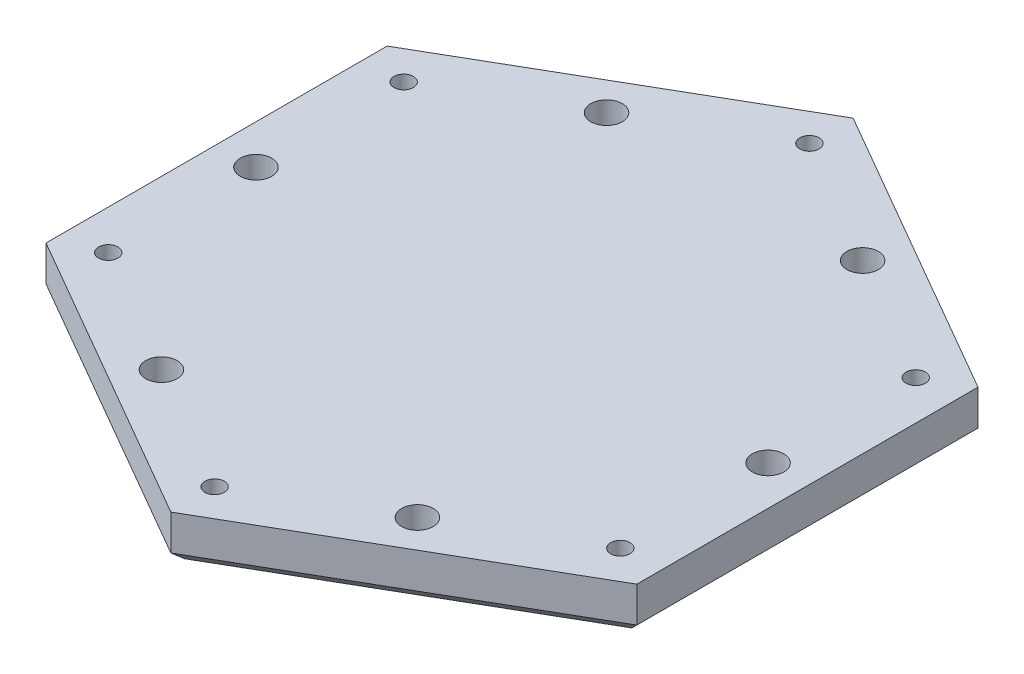
from build123d import *

# Parameters (mm, degrees)
EXTRUDE_1_DEPTH     = 12
CHAMFER_1_SIZE      = 3
SKETCH_2_R          = 4
EXTRUDE_2_DEPTH     = 12
HOLE_WIZARD_1_D     = 4.917
HOLE_WIZARD_1_DEPTH = 17.1
HOLE_WIZARD_1_TIP   = 1.477215832


with BuildPart() as part:
    # 草圖1 → 擠出1 (new body)
    with BuildSketch(Plane(origin=(0, 0, 0), x_dir=(-1, 0, 0), z_dir=(0, 1, 0))):
        Polygon((0, -86.602540378), (-75, -43.301270189), (-75, 43.301270189), (0, 86.602540378), (75, 43.301270189), (75, -43.301270189), align=None)
    extrude(amount=EXTRUDE_1_DEPTH)

    # 倒角1
    chamfer_1_edges = [part.edges().sort_by_distance(p)[0] for p in [
        (37.5, 0, -64.951905284),
        (75, 0, 0),
        (37.5, 0, 64.951905284),
        (-37.5, 0, 64.951905284),
        (-75, 0, 0),
        (-37.5, 0, -64.951905284),
    ]]
    chamfer(chamfer_1_edges, length=CHAMFER_1_SIZE)

    # 草圖2 → 擠出2 (cut)
    with BuildSketch(Plane(origin=(0, 12, 0), x_dir=(-1, 0, 0), z_dir=(0, 1, 0))):
        with Locations(Location((-32.5, 56.5, 0), (0, 0, 90))):
            Circle(SKETCH_2_R)
        with Locations(Location((32.5, 56.5, 0), (0, 0, 90))):
            Circle(SKETCH_2_R)
        with Locations(Location((-65, 0, 0), (0, 0, 90))):
            Circle(SKETCH_2_R)
        with Locations(Location((-32.5, -56.5, 0), (0, 0, 90))):
            Circle(SKETCH_2_R)
        with Locations(Location((32.5, -56.5, 0), (0, 0, 90))):
            Circle(SKETCH_2_R)
        with Locations(Location((65, 0, 0), (0, 0, 90))):
            Circle(SKETCH_2_R)
    extrude(amount=-EXTRUDE_2_DEPTH, mode=Mode.SUBTRACT)

    # 孔1
    with Locations(Plane(origin=(0, 12, 0), x_dir=(1, 0, 0), z_dir=(0, 1, 0))):
        with Locations((0, 75.5), (-65, 37.5), (65, 37.5), (-65, -37.5), (65, -37.5), (0, -75.5)):
            Hole(HOLE_WIZARD_1_D / 2, depth=HOLE_WIZARD_1_DEPTH)
            with Locations((0, 0, -(HOLE_WIZARD_1_DEPTH + HOLE_WIZARD_1_TIP / 2))):  # 118° drill point
                Cone(0, HOLE_WIZARD_1_D / 2, HOLE_WIZARD_1_TIP, mode=Mode.SUBTRACT)


solid = part.part
